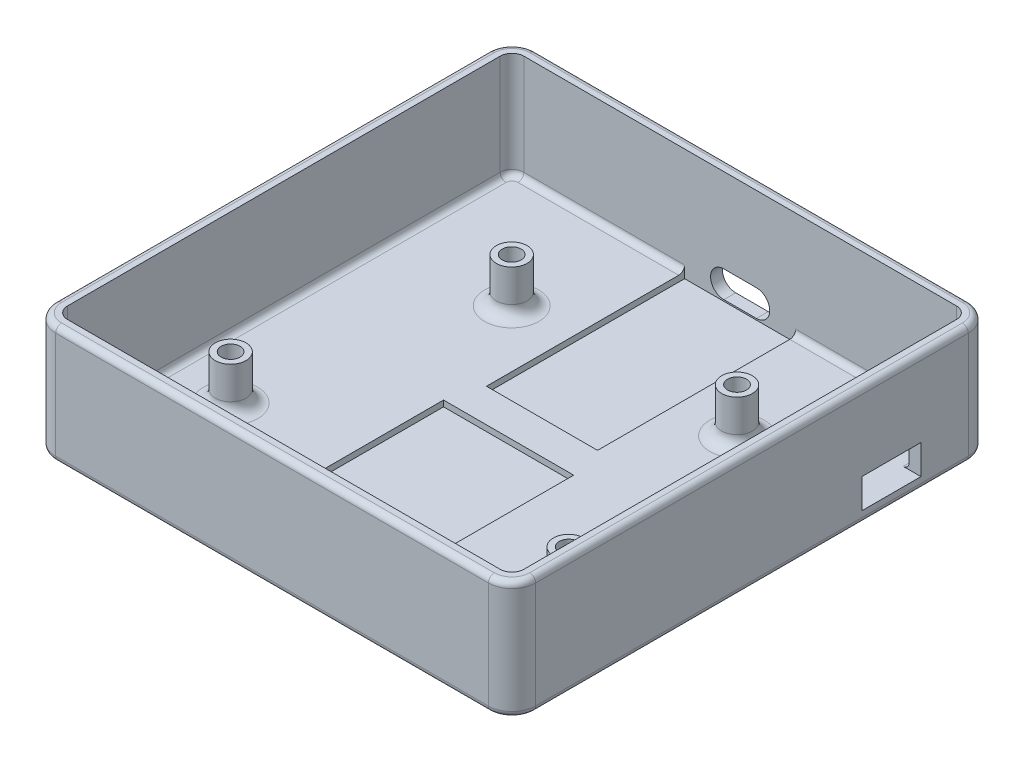
from build123d import *

# Parameters (mm, degrees)
SKETCH1_W           = 77.15
SKETCH1_H           = 77.15
BOSS_EXTRUDE1_DEPTH = 2
SKETCH2_W           = 81.15
SKETCH2_H           = 81.15
SKETCH2_W_2         = 77.15
SKETCH2_H_2         = 77.15
BOSS_EXTRUDE2_DEPTH = 20
SKETCH3_R           = 2.6
SKETCH3_R_2         = 1.6
BOSS_EXTRUDE4_DEPTH = 7.5
SKETCH18_W          = 22
SKETCH18_H          = 32
SKETCH18_W_2        = 18.78
SKETCH18_H_2        = 33.5
CUT_EXTRUDE4_DEPTH  = 1
SKETCH7_R           = 4
CUT_EXTRUDE1_DEPTH  = 1
CUT_EXTRUDE2_DEPTH  = 2
SKETCH16_W          = 10
SKETCH16_H          = 5
CUT_EXTRUDE3_DEPTH  = 2
FILLET1_R           = 2
FILLET6_R           = 4
FILLET7_R           = 2
FILLET5_R           = 1
FILLET9_R           = 1


with BuildPart() as part:
    # Sketch1 → Boss-Extrude1 (new body)
    with BuildSketch(Plane(origin=(0, 0, 0), x_dir=(1, 0, 0), z_dir=(0, 1, 0))):
        Rectangle(SKETCH1_W, SKETCH1_H)
    extrude(amount=BOSS_EXTRUDE1_DEPTH)

    # Sketch2 → Boss-Extrude2 (add)
    with BuildSketch(Plane(origin=(0, 0, 0), x_dir=(1, 0, 0), z_dir=(0, 1, 0))):
        Rectangle(SKETCH2_W, SKETCH2_H)
        Rectangle(SKETCH2_W_2, SKETCH2_H_2, mode=Mode.SUBTRACT)
    extrude(amount=BOSS_EXTRUDE2_DEPTH)

    # Sketch3 → Boss-Extrude4 (add)
    # profile 1 of 4: a face of its own
    with BuildSketch(Plane(origin=(0, 2, 0), x_dir=(1, 0, 0), z_dir=(0, 1, 0))):
        with Locations(Location((-28.58, -19, 0), (0, 0, 90))):
            Circle(SKETCH3_R)
        with Locations(Location((-28.58, -19, 0), (0, 0, 90))):
            Circle(SKETCH3_R_2, mode=Mode.SUBTRACT)
    # profile 2 of 4: a face of its own
    with BuildSketch(Plane(origin=(0, 2, 0), x_dir=(1, 0, 0), z_dir=(0, 1, 0))):
        with Locations(Location((-19.05, 19, 0), (0, 0, 90))):
            Circle(SKETCH3_R)
        with Locations(Location((-19.05, 19, 0), (0, 0, 90))):
            Circle(SKETCH3_R_2, mode=Mode.SUBTRACT)
    # profile 3 of 4: a face of its own
    with BuildSketch(Plane(origin=(0, 2, 0), x_dir=(1, 0, 0), z_dir=(0, 1, 0))):
        with Locations(Location((28.58, -19, 0), (0, 0, 90))):
            Circle(SKETCH3_R)
        with Locations(Location((28.58, -19, 0), (0, 0, 90))):
            Circle(SKETCH3_R_2, mode=Mode.SUBTRACT)
    # profile 4 of 4: a face of its own
    with BuildSketch(Plane(origin=(0, 2, 0), x_dir=(1, 0, 0), z_dir=(0, 1, 0))):
        with Locations(Location((19.05, 19, 0), (0, 0, 90))):
            Circle(SKETCH3_R)
        with Locations(Location((19.05, 19, 0), (0, 0, 90))):
            Circle(SKETCH3_R_2, mode=Mode.SUBTRACT)
    extrude(amount=BOSS_EXTRUDE4_DEPTH)

    # Sketch18 → Cut-Extrude4 (cut)
    with BuildSketch(Plane(origin=(0, 2, 0), x_dir=(1, 0, 0), z_dir=(0, 1, 0))):
        with Locations((0, -16.575)):
            Rectangle(SKETCH18_W, SKETCH18_H)
        with Locations((0, 21.825)):
            Rectangle(SKETCH18_W_2, SKETCH18_H_2)
    extrude(amount=-CUT_EXTRUDE4_DEPTH, mode=Mode.SUBTRACT)

    # Sketch7 → Cut-Extrude1 (cut)
    with BuildSketch(Plane.XZ):
        with Locations(Location((-24.575, -24.575, 0), (0, 0, 270))):
            Circle(SKETCH7_R)
        with Locations(Location((-24.575, 24.575, 0), (0, 0, 270))):
            Circle(SKETCH7_R)
        with Locations(Location((24.575, 24.575, 0), (0, 0, 270))):
            Circle(SKETCH7_R)
        with Locations(Location((24.575, -24.575, 0), (0, 0, 270))):
            Circle(SKETCH7_R)
    extrude(amount=-CUT_EXTRUDE1_DEPTH, mode=Mode.SUBTRACT)

    # Sketch10 → Cut-Extrude2 (cut)
    with BuildSketch(Plane(origin=(0, 0, -38.575), x_dir=(-1, 0, 0), z_dir=(0, 0, -1))):
        with BuildLine():
            Line((-2.75, 5.75), (2.75, 5.75))
            ThreePointArc((2.75, 5.75), (5, 3.5), (2.75, 1.25))
            Line((2.75, 1.25), (-2.75, 1.25))
            ThreePointArc((-2.75, 1.25), (-5, 3.5), (-2.75, 5.75))
        make_face()
    extrude(amount=CUT_EXTRUDE2_DEPTH, mode=Mode.SUBTRACT)

    # Sketch16 → Cut-Extrude3 (cut)
    with BuildSketch(Plane.ZY.offset(-38.575)):
        with Locations((-23.575, 4.5)):
            Rectangle(SKETCH16_W, SKETCH16_H)
    extrude(amount=-CUT_EXTRUDE3_DEPTH, mode=Mode.SUBTRACT)

    # Fillet1
    fillet1_edges = [part.edges().sort_by_distance(p)[0] for p in [
        (28.58, 2, 21.6),
        (19.05, 2, -16.4),
        (-28.58, 2, 21.6),
        (-19.05, 2, -16.4),
    ]]
    fillet(fillet1_edges, radius=FILLET1_R)

    # Fillet6
    fillet6_edges = [part.edges().sort_by_distance(p)[0] for p in [
        (-40.575, 10, 40.575),
        (40.575, 10, 40.575),
        (40.575, 10, -40.575),
        (-40.575, 10, -40.575),
    ]]
    fillet(fillet6_edges, radius=FILLET6_R)

    # Fillet7
    fillet7_edges = [part.edges().sort_by_distance(p)[0] for p in [
        (38.575, 11, 38.575),
        (38.575, 11, -38.575),
        (-38.575, 11, -38.575),
        (-38.575, 11, 38.575),
    ]]
    fillet(fillet7_edges, radius=FILLET7_R)

    # Fillet5
    fillet5_edges = [part.edges().sort_by_distance(p)[0] for p in [
        (0, 0, -40.575),
        (0, 20, -40.575),
        (0, 0, 40.575),
        (-40.575, 0, 0),
        (40.575, 0, 0),
        (39.403427125, 0, 39.403427125),
        (-39.403427125, 0, 39.403427125),
        (-39.403427125, 0, -39.403427125),
        (39.403427125, 0, -39.403427125),
        (40.575, 20, 0),
        (0, 20, 40.575),
        (-40.575, 20, 0),
        (39.403427125, 20, 39.403427125),
        (-39.403427125, 20, 39.403427125),
        (-39.403427125, 20, -39.403427125),
        (39.403427125, 20, -39.403427125),
    ]]
    fillet(fillet5_edges, radius=FILLET5_R)

    # Fillet9
    fillet9_edges = [part.edges().sort_by_distance(p)[0] for p in [
        (38.575, 2, -32.575),
        (38.575, 2, 9),
        (-38.575, 2, 0),
        (0, 2, 38.575),
        (22.9825, 2, -38.575),
        (37.989213562, 2, 37.989213562),
        (-37.989213562, 2, 37.989213562),
        (-37.989213562, 2, -37.989213562),
        (37.989213562, 2, -37.989213562),
        (-22.9825, 2, -38.575),
    ]]
    fillet(fillet9_edges, radius=FILLET9_R)


solid = part.part
